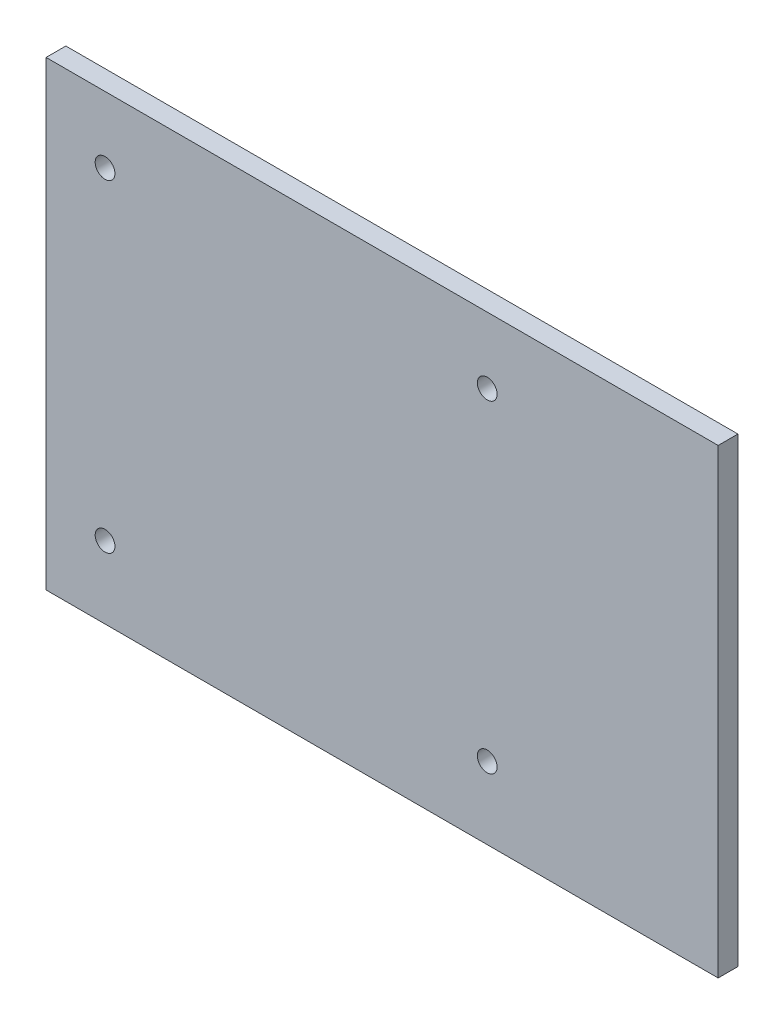
from build123d import *

# Parameters (mm, degrees)
SKETCH1_W           = 102
SKETCH1_H           = 70
SKETCH1_R           = 1.5
BOSS_EXTRUDE1_DEPTH = 3


with BuildPart() as part:
    # Sketch1 → Boss-Extrude1 (new body)
    with BuildSketch(Plane.XY):
        with Locations((24.340909091, -15.716942149)):
            Rectangle(SKETCH1_W, SKETCH1_H)
        with Locations((-17.709090909, -39.766942149)):
            Circle(SKETCH1_R, mode=Mode.SUBTRACT)
        with Locations(Location((-17.709090909, 9.233057851, 0), (0, 0, 180))):
            Circle(SKETCH1_R, mode=Mode.SUBTRACT)
        with Locations(Location((40.290909091, -39.766942149, 0), (0, 0, 180))):
            Circle(SKETCH1_R, mode=Mode.SUBTRACT)
        with Locations((40.290909091, 9.233057851)):
            Circle(SKETCH1_R, mode=Mode.SUBTRACT)
    extrude(amount=BOSS_EXTRUDE1_DEPTH)


solid = part.part
